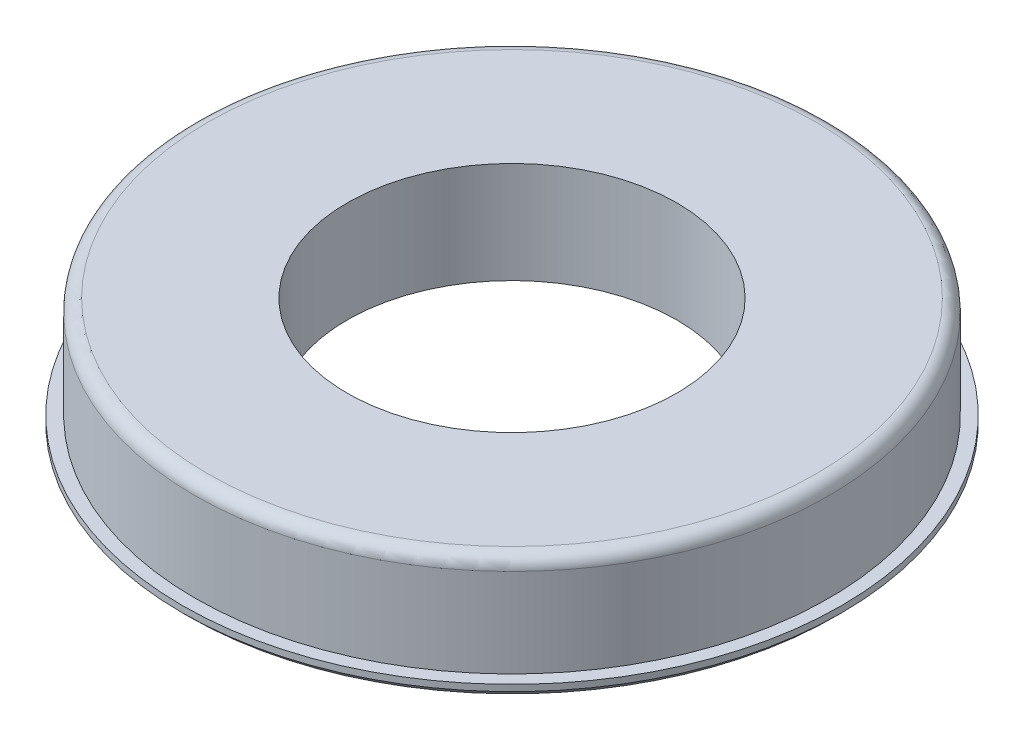
from build123d import *

# Parameters (mm, degrees)
FILLET1_R     = 1
CHAMFER1_SIZE = 0.5


with BuildPart() as part:
    # Sketch1 → Revolve1 (revolve)
    with BuildSketch(Plane.XY):
        Polygon((-26, 0), (-25, 0), (-25, 8), (-13, 8), (-13, 0), (-15.5, 0), (-15.5, 2.5), (-22.5, 2.5), (-22.5, -1), (-26, -1), align=None)
    revolve(axis=Axis((0, 0, 0), (0, 1, 0)))

    # Fillet1
    fillet1_edges = [part.edges().sort_by_distance(p)[0] for p in [
        (15.5, 2.5, 0),
        (22.5, 2.5, 0),
        (25, 8, 0),
    ]]
    fillet(fillet1_edges, radius=FILLET1_R)

    # Chamfer1
    chamfer1_edges = [part.edges().sort_by_distance(p)[0] for p in [
        (22.5, -1, 0),
        (26, -1, 0),
    ]]
    chamfer(chamfer1_edges, length=CHAMFER1_SIZE)


solid = part.part
